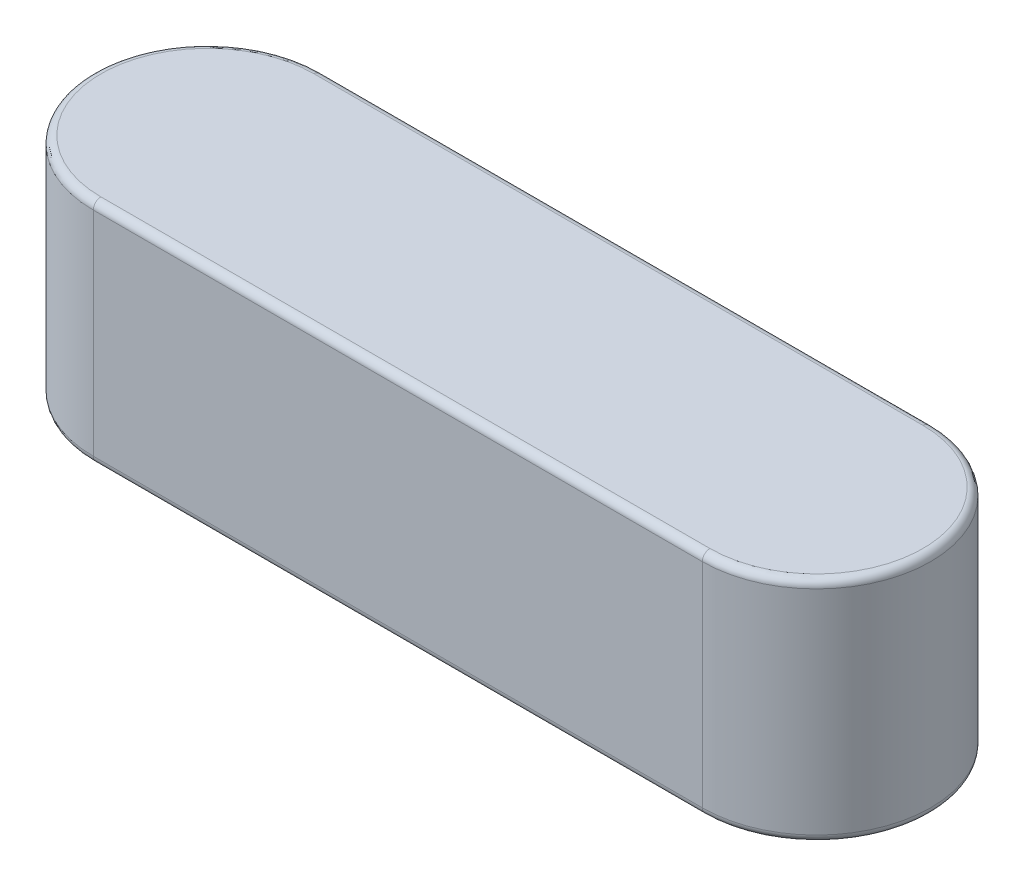
from build123d import *

# Parameters (mm, degrees)
BOSS_EXTRUDE1_DEPTH = 6
FILLET1_R           = 0.2


with BuildPart() as part:
    # Sketch1 → Boss-Extrude1 (new body)
    with BuildSketch(Plane(origin=(0, 0, 0), x_dir=(1, 0, 0), z_dir=(0, 1, 0))):
        with BuildLine():
            Line((0, 3), (16, 3))
            ThreePointArc((16, 3), (19, 0), (16, -3))
            Line((16, -3), (0, -3))
            ThreePointArc((0, -3), (-3, 0), (0, 3))
        make_face()
    extrude(amount=BOSS_EXTRUDE1_DEPTH)

    # Fillet1
    fillet1_edges = [part.edges().sort_by_distance(p)[0] for p in [
        (19, 6, 0),
        (8, 6, -3),
        (-3, 6, 0),
        (8, 0, -3),
        (19, 0, 0),
        (8, 0, 3),
        (-3, 0, 0),
        (8, 6, 3),
    ]]
    fillet(fillet1_edges, radius=FILLET1_R)


solid = part.part
